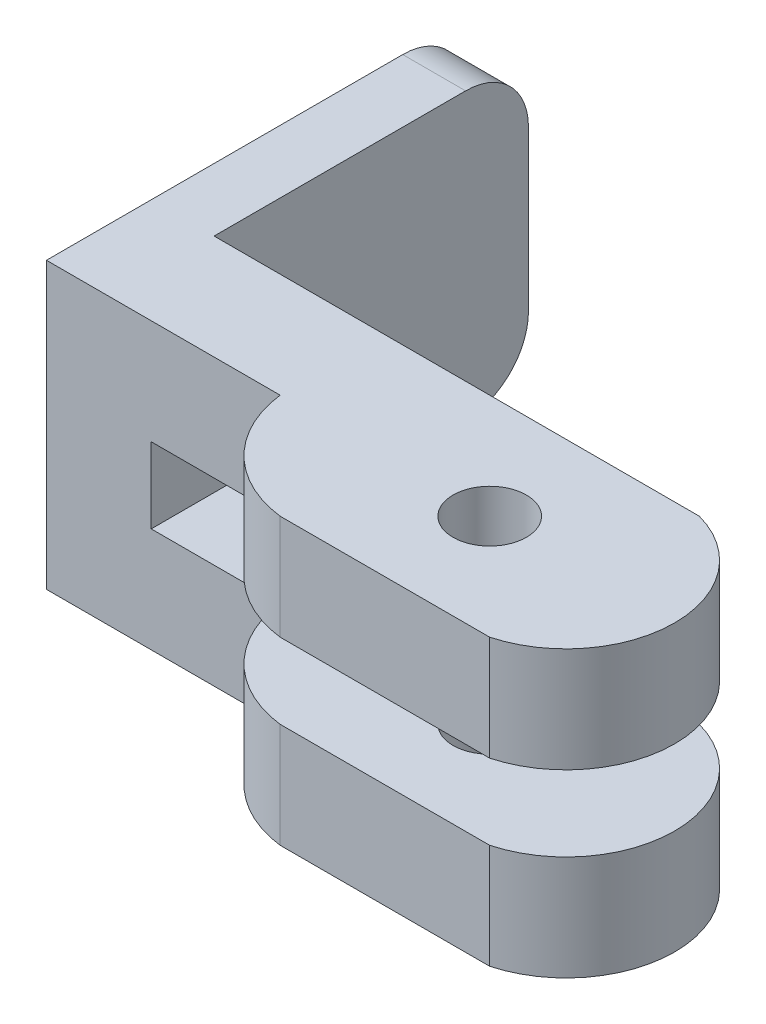
from build123d import *

# Parameters (mm, degrees)
SALIENTE_EXTRUIR1_DEPTH = 10
CROQUIS2_R              = 1.75
CORTAR_EXTRUIR1_DEPTH   = 92.569427212
CROQUIS3_W              = 3
CROQUIS3_H              = 13.6
SALIENTE_EXTRUIR2_DEPTH = 15
CHAFL_N1_SIZE           = 10
CHAFL_N1_SIZE2          = 2.679491924
REDONDEO1_R             = 3
CROQUIS4_W              = 166.722641079
CROQUIS4_H              = 47.037936504
CORTAR_EXTRUIR2_DEPTH   = 93.22299515


with BuildPart() as part:
    # Croquis1 → Saliente-Extruir1 (new body)
    with BuildSketch(Plane.XY):
        Polygon((-90, -6.8), (-90, -1.8), (-65, -1.8), (-65, 1.8), (-90, 1.8), (-90, 6.8), (90, 6.8), (90, 1.8), (65, 1.8), (65, -1.8), (90, -1.8), (90, -6.8), align=None)
    extrude(amount=SALIENTE_EXTRUIR1_DEPTH)

    # Croquis2 → Cortar-Extruir1 (cut, through all)
    with BuildSketch(Plane(origin=(0, 6.8, 0), x_dir=(1, 0, 0), z_dir=(0, 1, 0))):
        with BuildLine():
            ThreePointArc((-86.15, -10), (-89.972889442, -5), (-86.15, 0))
            Line((-86.15, 0), (-90, 0))
            Line((-90, 0), (-90, -10))
            Line((-90, -10), (-86.15, -10))
        make_face()
        with BuildLine():
            Line((86.15, -10), (90, -10))
            Line((90, -10), (90, 0))
            Line((90, 0), (86.15, 0))
            ThreePointArc((86.15, 0), (89.972889442, -5), (86.15, -10))
        make_face()
        with BuildLine():
            Line((71.15, -5), (-71.15, -5))
            ThreePointArc((-71.15, -5), (-72.786720767, -8.363279233), (-76.15, -10))
            Line((-76.15, -10), (76.15, -10))
            ThreePointArc((76.15, -10), (72.786720767, -8.363279233), (71.15, -5))
        make_face()
        with Locations(Location((81.15, -5, 0), (0, 0, 270))):
            Circle(CROQUIS2_R)
    extrude(amount=-CORTAR_EXTRUIR1_DEPTH, mode=Mode.SUBTRACT)

    # Croquis3 → Saliente-Extruir2 (add)
    with BuildSketch(Plane(origin=(0, 0, 0), x_dir=(-1, 0, 0), z_dir=(0, 0, -1))):
        with Locations((-61.5, 0)):
            Rectangle(CROQUIS3_W, CROQUIS3_H)
        with Locations((61.5, 0)):
            Rectangle(CROQUIS3_W, CROQUIS3_H)
    extrude(amount=SALIENTE_EXTRUIR2_DEPTH)

    # Chaflán1
    chafl_n1_edges = [part.edges().sort_by_distance(p)[0] for p in [
        (0, -6.8, 0),
    ]]
    chafl_n1_side = [part.faces().sort_by_distance(p)[0] for p in [
        (0, 0, 0),
    ]]
    chamfer(chafl_n1_edges, length=CHAFL_N1_SIZE, length2=CHAFL_N1_SIZE2, reference=chafl_n1_side[0])

    # Redondeo1
    redondeo1_edges = [part.edges().sort_by_distance(p)[0] for p in [
        (61.5, 6.8, -15),
        (61.5, -6.8, -15),
        (-61.5, 6.8, -15),
        (-61.5, -6.8, -15),
    ]]
    fillet(redondeo1_edges, radius=REDONDEO1_R)

    # Croquis4 → Cortar-Extruir2 (cut, through all)
    with BuildSketch(Plane(origin=(0, -6.8, 0), x_dir=(-1, 0, 0), z_dir=(0, -1, 0))):
        with Locations((23.36132054, -0.816815002)):
            Rectangle(CROQUIS4_W, CROQUIS4_H)
    extrude(amount=-CORTAR_EXTRUIR2_DEPTH, mode=Mode.SUBTRACT)


solid = part.part
